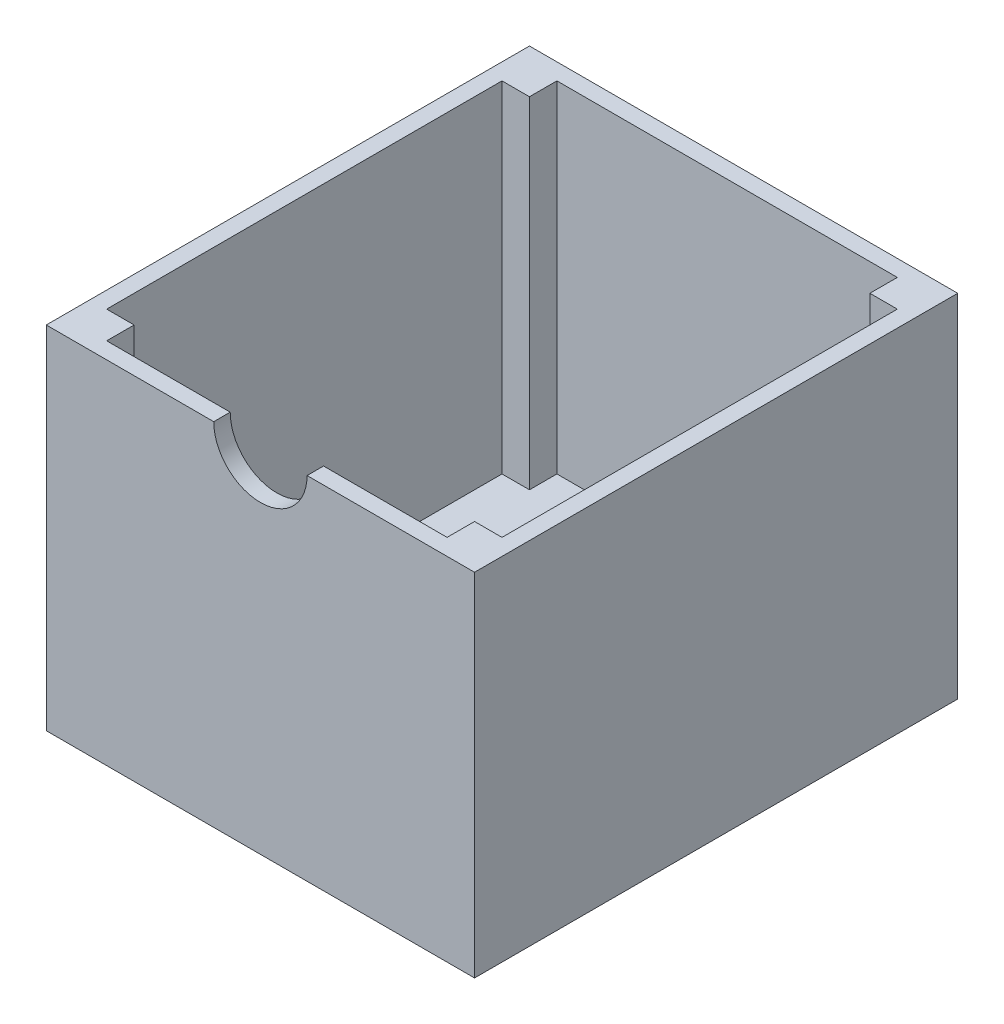
from build123d import *

# Parameters (mm, degrees)
SKETCH1_W           = 72
SKETCH1_H           = 82
BOSS_EXTRUDE1_DEPTH = 2
BOSS_EXTRUDE2_START = -2
SKETCH2_W           = 78
SKETCH2_H           = 88
BOSS_EXTRUDE2_DEPTH = 64
SKETCH4_R           = 8.5
CUT_EXTRUDE1_DEPTH  = 3


with BuildPart() as part:
    # Sketch1 → Boss-Extrude1 (new body)
    with BuildSketch(Plane(origin=(0, 0, 0), x_dir=(1, 0, 0), z_dir=(0, 1, 0))):
        with Locations((36, 41)):
            Rectangle(SKETCH1_W, SKETCH1_H)
    extrude(amount=BOSS_EXTRUDE1_DEPTH)

    # Sketch2 → Boss-Extrude2 (add)
    with BuildSketch(Plane(origin=(0, 2, 0), x_dir=(1, 0, 0), z_dir=(0, 1, 0)).offset(BOSS_EXTRUDE2_START)):
        with Locations((36, 41)):
            Rectangle(SKETCH2_W, SKETCH2_H)
        Polygon((5, 82), (67, 82), (67, 77), (72, 77), (72, 5), (67, 5), (67, 0), (5, 0), (5, 5), (0, 5), (0, 77), (5, 77), align=None, mode=Mode.SUBTRACT)
    extrude(amount=BOSS_EXTRUDE2_DEPTH)

    # Sketch4 → Cut-Extrude1 (cut)
    with BuildSketch(Plane.XY.offset(3)):
        with Locations((36, 64)):
            Circle(SKETCH4_R)
    extrude(amount=-CUT_EXTRUDE1_DEPTH, mode=Mode.SUBTRACT)


solid = part.part
